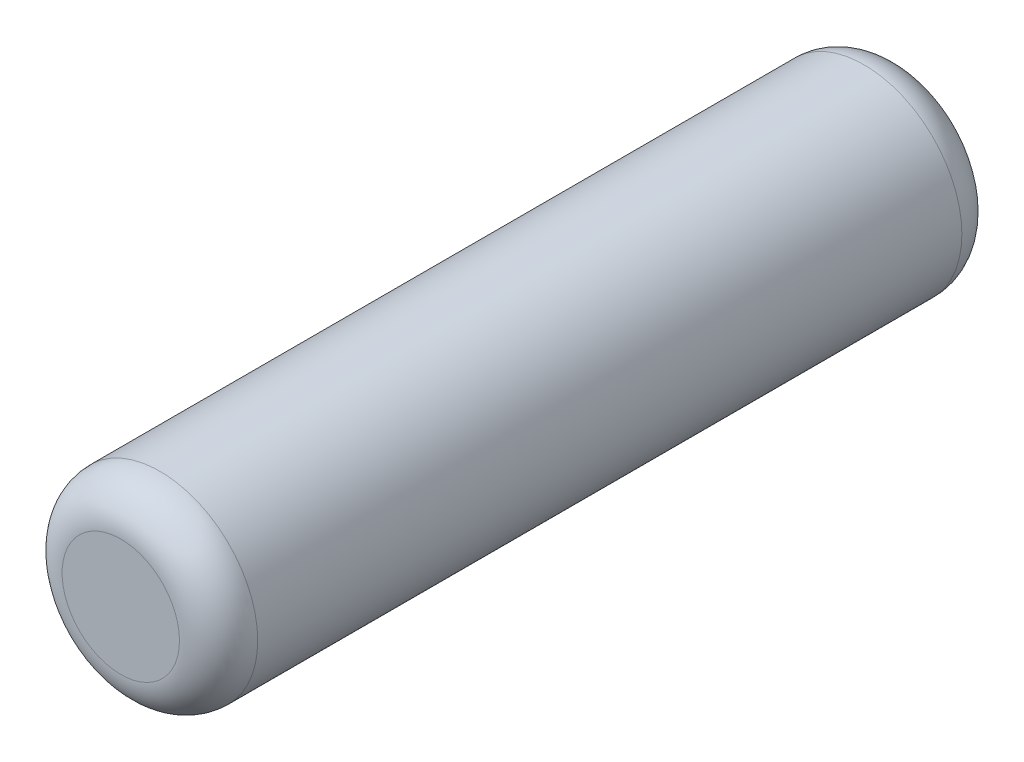
from build123d import *

# Parameters (mm, degrees)
CROQUIS1_R              = 2.5
SALIENTE_EXTRUIR1_DEPTH = 10
REDONDEO1_R             = 1


with BuildPart() as part:
    # Croquis1 → Saliente-Extruir1 (new, symmetric)
    with BuildSketch(Plane.XY):
        Circle(CROQUIS1_R)
    extrude(amount=SALIENTE_EXTRUIR1_DEPTH, both=True)

    # Redondeo1
    redondeo1_edges = [part.edges().sort_by_distance(p)[0] for p in [
        (-2.5, 0, -10),
        (-2.5, 0, 10),
    ]]
    fillet(redondeo1_edges, radius=REDONDEO1_R)


solid = part.part
